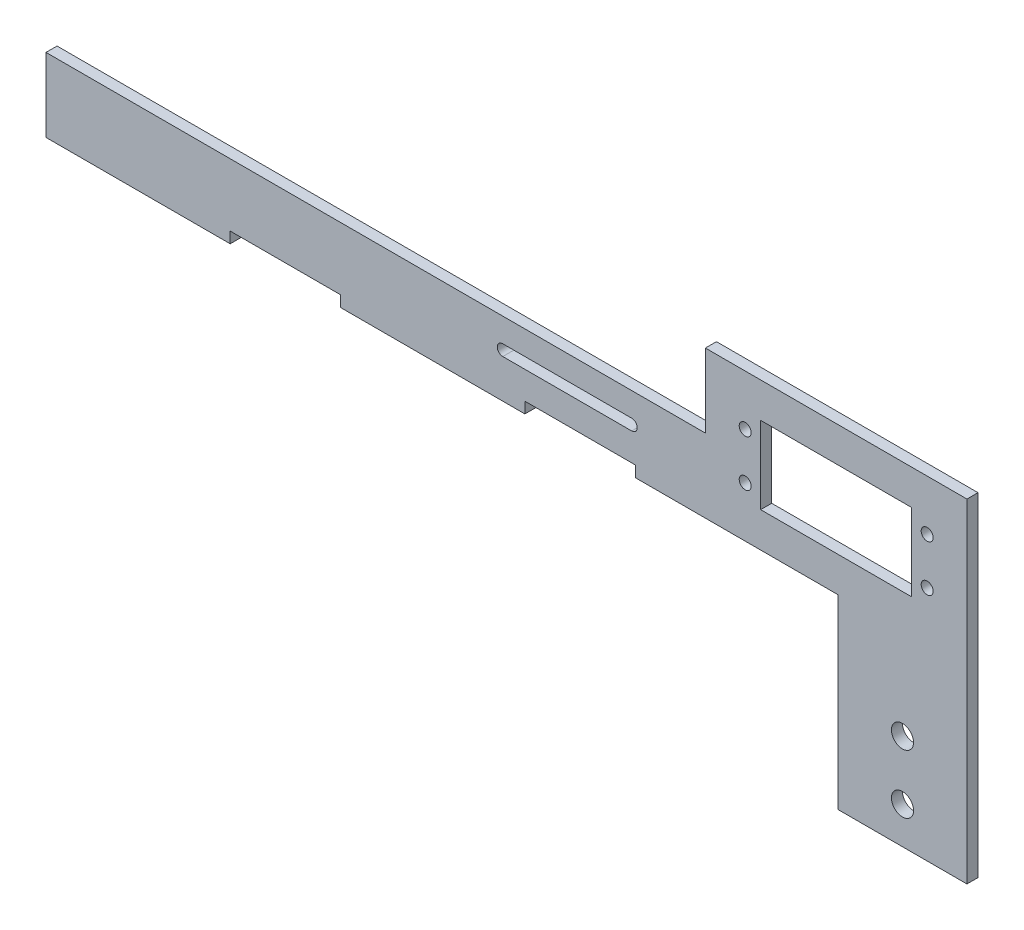
from build123d import *

# Parameters (mm, degrees)
ESBO_O1_R                = 1.625
ESBO_O1_R_2              = 3
ESBO_O1_W                = 41
ESBO_O1_H                = 21
RESSALTO_EXTRUS_O1_DEPTH = 3


with BuildPart() as part:
    # Esboço1 → Ressalto-extrusão1 (new body)
    with BuildSketch(Plane.XY):
        Polygon((215, -20), (160, -20), (160, -17), (130, -17), (130, -20), (80, -20), (80, -17), (50, -17), (50, -20), (0, -20), (0, 0), (179, 0), (179, 20), (250, 20), (250, -20), (250, -70.5), (215, -70.5), align=None)
        with Locations((189.8, 6.3)):
            Circle(ESBO_O1_R, mode=Mode.SUBTRACT)
        with Locations((239.2, 6.3)):
            Circle(ESBO_O1_R, mode=Mode.SUBTRACT)
        with Locations((239.2, -6.3)):
            Circle(ESBO_O1_R, mode=Mode.SUBTRACT)
        with Locations((189.8, -6.3)):
            Circle(ESBO_O1_R, mode=Mode.SUBTRACT)
        with Locations((232.5, -60.5)):
            Circle(ESBO_O1_R_2, mode=Mode.SUBTRACT)
        with Locations((232.5, -44.5)):
            Circle(ESBO_O1_R_2, mode=Mode.SUBTRACT)
        with Locations((214.5, 0)):
            Rectangle(ESBO_O1_W, ESBO_O1_H, mode=Mode.SUBTRACT)
        with BuildLine():
            Line((124, -6.5), (159, -6.5))
            ThreePointArc((159, -6.5), (160.5, -8), (159, -9.5))
            Line((159, -9.5), (124, -9.5))
            ThreePointArc((124, -9.5), (122.5, -8), (124, -6.5))
        make_face(mode=Mode.SUBTRACT)
    extrude(amount=RESSALTO_EXTRUS_O1_DEPTH)


solid = part.part
